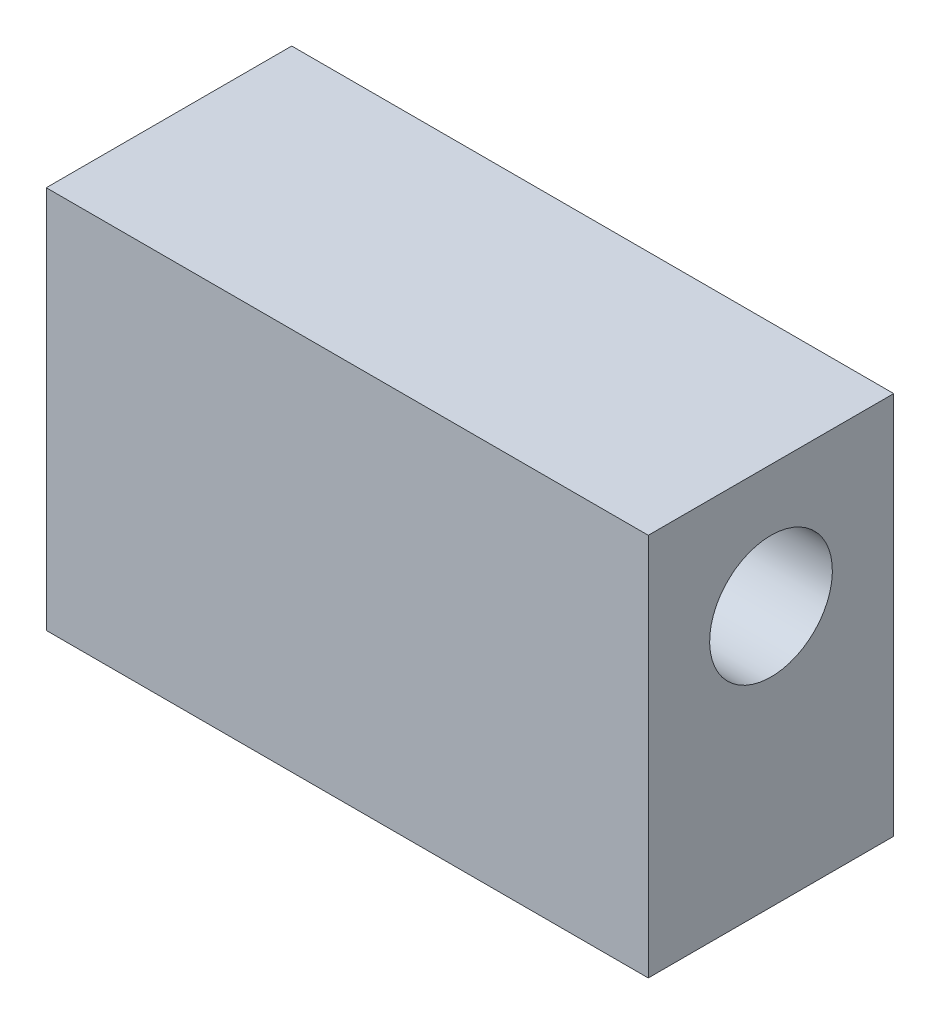
from build123d import *

# Parameters (mm, degrees)
SKETCH3_W                      = 31.148374891
SKETCH3_H                      = 19.837641971
BOSS_EXTRUDE1_DEPTH            = 6.35
SKETCH4_R                      = 3.175
CUT_EXTRUDE1_DEPTH             = 9.525
SKETCH5_R                      = 3.175
CUT_EXTRUDE5_DEPTH             = 9.525
CUT_EXTRUDE5_DIRECTION_2_REACH = 33.299
SKETCH6_R                      = 3.175
CUT_EXTRUDE6_DEPTH             = 9.525


with BuildPart() as part:
    # Sketch3 → Boss-Extrude1 (new, symmetric)
    with BuildSketch(Plane.XY):
        with Locations((15.574187446, -9.918820986)):
            Rectangle(SKETCH3_W, SKETCH3_H)
    extrude(amount=BOSS_EXTRUDE1_DEPTH, both=True)

    # Sketch4 → Cut-Extrude1 (cut)
    with BuildSketch(Plane.ZY):
        with Locations(Location((0, -6.35, 0), (0, 0, 270))):
            Circle(SKETCH4_R)
    cut_extrude1 = extrude(amount=-CUT_EXTRUDE1_DEPTH, mode=Mode.SUBTRACT)

    # Sketch5 → Cut-Extrude5 (cut)
    with BuildSketch(Plane(origin=(7.787093723, -19.837641971, 0), x_dir=(-0.8660254037844382, 0.500000000000001, 0), z_dir=(-0.500000000000001, -0.8660254037844382, 0))):
        with Locations(Location((0, 0, 0), (0, 0, 180))):
            Circle(SKETCH5_R)
    cut_extrude5 = extrude(amount=-CUT_EXTRUDE5_DEPTH, mode=Mode.SUBTRACT)

    # Sketch5 → Cut-Extrude5 direction 2 (cut, up to next)
    with BuildSketch(Plane(origin=(7.787093723, -19.837641971, 0), x_dir=(-0.8660254037844382, 0.500000000000001, 0), z_dir=(-0.500000000000001, -0.8660254037844382, 0)), mode=Mode.PRIVATE) as cut_extrude5_direction_2_sk1:
        with Locations(Location((0, 0, 0), (0, 0, 180))):
            Circle(SKETCH5_R)
    cut_extrude5_direction_2_tool1 = extrude(cut_extrude5_direction_2_sk1.sketch, amount=CUT_EXTRUDE5_DIRECTION_2_REACH, mode=Mode.PRIVATE) & part.part
    cut_extrude5_direction_2 = cut_extrude5_direction_2_tool1.solids().sort_by_distance((7.787094, -19.837642, 0))[0]
    add(cut_extrude5_direction_2, mode=Mode.SUBTRACT)

    # Sketch6 → Cut-Extrude6 (cut)
    with BuildSketch(Plane(origin=(0, 0, -6.35), x_dir=(-1, 0, 0), z_dir=(0, 0, -1))):
        with Locations((-15.574187445, -6.35)):
            Circle(SKETCH6_R)
    extrude(amount=-CUT_EXTRUDE6_DEPTH, mode=Mode.SUBTRACT)

    # Mirror1: Cut-Extrude1, Cut-Extrude5, Cut-Extrude5 direction 2 across plane
    add(cut_extrude1.mirror(Plane.ZY.offset(-15.574187445)), mode=Mode.SUBTRACT)
    add(cut_extrude5.mirror(Plane.ZY.offset(-15.574187445)), mode=Mode.SUBTRACT)
    add(cut_extrude5_direction_2.mirror(Plane.ZY.offset(-15.574187445)), mode=Mode.SUBTRACT)


solid = part.part
